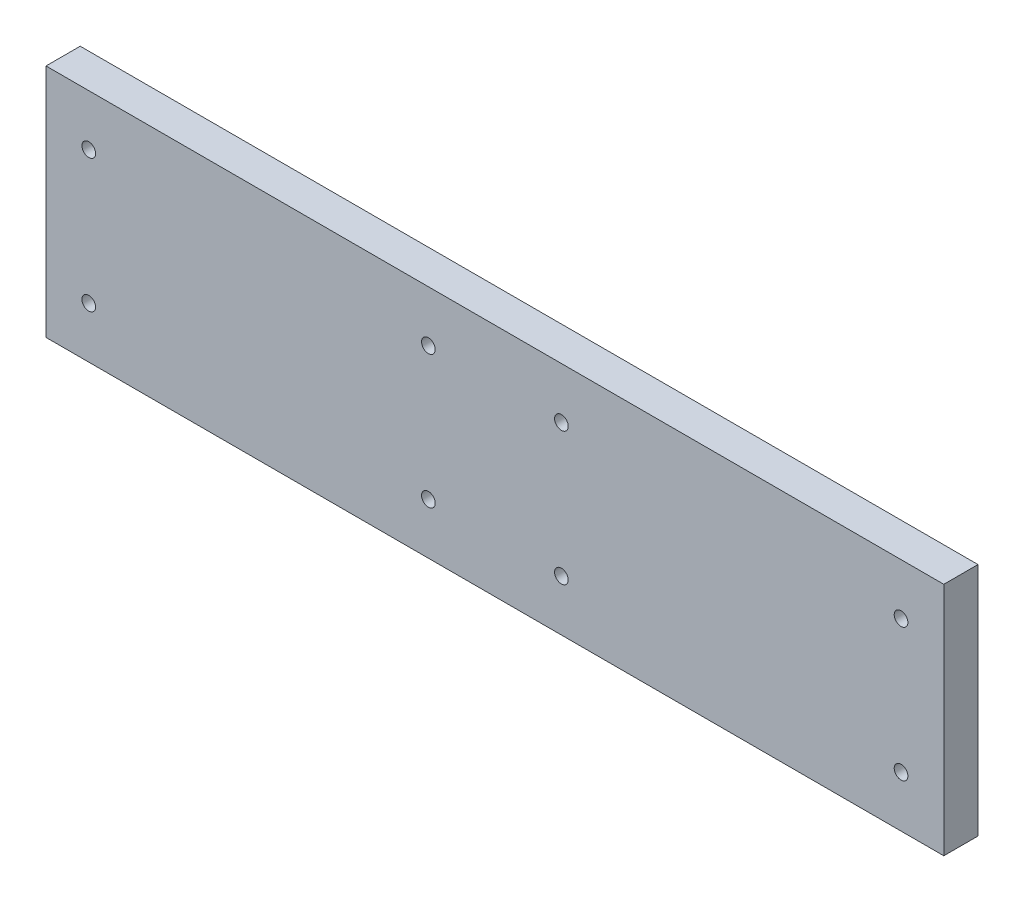
from build123d import *

# Parameters (mm, degrees)
SKETCH1_W           = 210
SKETCH1_H           = 55
BOSS_EXTRUDE1_DEPTH = 8
SKETCH2_R           = 1.6
CUT_EXTRUDE2_DEPTH  = 9


with BuildPart() as part:
    # Sketch1 → Boss-Extrude1 (new body)
    with BuildSketch(Plane.XY):
        Rectangle(SKETCH1_W, SKETCH1_H)
    extrude(amount=BOSS_EXTRUDE1_DEPTH)

    # Sketch2 → Cut-Extrude2 (cut)
    with BuildSketch(Plane.XY):
        with Locations(Location((15.556349186, 15.556349186, 0), (0, 0, 180))):
            Circle(SKETCH2_R)
        with Locations(Location((-15.556349186, 15.556349186, 0), (0, 0, 180))):
            Circle(SKETCH2_R)
        with Locations(Location((-15.556349186, -15.556349186, 0), (0, 0, 180))):
            Circle(SKETCH2_R)
        with Locations(Location((15.556349186, -15.556349186, 0), (0, 0, 180))):
            Circle(SKETCH2_R)
        with Locations(Location((-95, 15.556349186, 0), (0, 0, 180))):
            Circle(SKETCH2_R)
        with Locations(Location((-95, -15.556349186, 0), (0, 0, 180))):
            Circle(SKETCH2_R)
        with Locations(Location((95, 15.556349186, 0), (0, 0, 180))):
            Circle(SKETCH2_R)
        with Locations(Location((95, -15.556349186, 0), (0, 0, 180))):
            Circle(SKETCH2_R)
    extrude(amount=CUT_EXTRUDE2_DEPTH, mode=Mode.SUBTRACT)


solid = part.part
